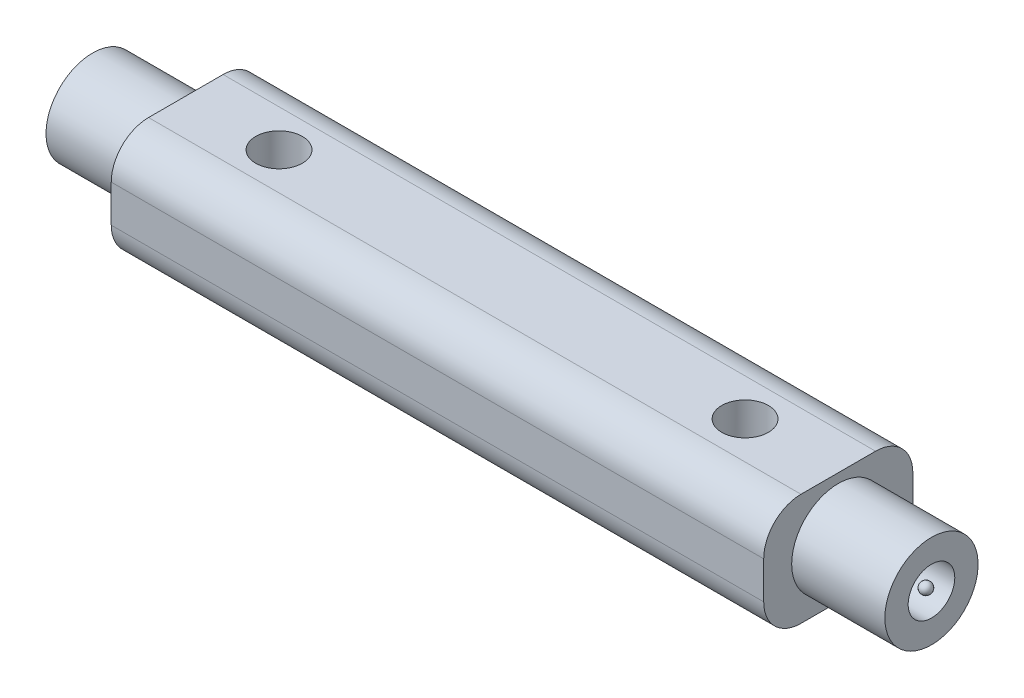
from build123d import *

# Parameters (mm, degrees)
SKETCH_1_W          = 8
SKETCH_1_H          = 6
EXTRUDE_1_DEPTH     = 17.5
SKETCH_2_R          = 2.5
EXTRUDE_2_DEPTH     = 22.5
FILLET_1_R          = 2
HOLE_WIZARD_M3_1_D  = 2.5
SKETCH_6_R          = 1
CUT_EXTRUDE_1_DEPTH = 24.627314701
HOLE_WIZARD_M3_2_D  = 2.5


with BuildPart() as part:
    # 草圖1 → 填料-伸長1 (new, symmetric)
    with BuildSketch(Plane(origin=(0, 0, 0), x_dir=(0, 0, -1), z_dir=(1, 0, 0))):
        Rectangle(SKETCH_1_W, SKETCH_1_H)
    extrude(amount=EXTRUDE_1_DEPTH, both=True)

    # 草圖2 → 填料-伸長2 (add, symmetric)
    with BuildSketch(Plane(origin=(0, 0, 0), x_dir=(0, 0, -1), z_dir=(1, 0, 0))):
        with Locations(Location((0, 0, 0), (0, 0, 180))):
            Circle(SKETCH_2_R)
    extrude(amount=EXTRUDE_2_DEPTH, both=True)

    # 圓角1
    fillet_1_edges = [part.edges().sort_by_distance(p)[0] for p in [
        (0, 3, 4),
        (0, 3, -4),
        (0, -3, -4),
        (0, -3, 4),
    ]]
    fillet(fillet_1_edges, radius=FILLET_1_R)

    # M3 螺紋孔1 (through all)
    with Locations(Plane(origin=(22.5, 0, 0), x_dir=(0, 0, -1), z_dir=(1, 0, 0))):
        with Locations((0, 0)):
            Hole(HOLE_WIZARD_M3_1_D / 2)

    # 草圖6 → 除料-伸長1 (cut, through all)
    with BuildSketch(Plane(origin=(0, 3, 0), x_dir=(1, 0, 0), z_dir=(0, 1, 0))):
        with Locations(Location((-12.5, 0, 0), (0, 0, 270))):
            Circle(SKETCH_6_R)
        with Locations(Location((12.5, 0, 0), (0, 0, 270))):
            Circle(SKETCH_6_R)
    extrude(amount=-CUT_EXTRUDE_1_DEPTH, mode=Mode.SUBTRACT)

    # M3 螺紋孔2 (through all)
    with Locations(Plane(origin=(-12.5, 3, 0), x_dir=(0, 0, 1), z_dir=(0, 1, 0))):
        with Locations((0, 0), (0, 25)):
            Hole(HOLE_WIZARD_M3_2_D / 2)


with BuildPart() as body_2:
    # 草圖10 → 旋轉1 (revolve)
    with BuildSketch(Plane(origin=(0, 0, 0), x_dir=(1, 0, 0), z_dir=(0, 1, 0))):
        with BuildLine():
            Line((21.9, 0), (22.5, 0))
            ThreePointArc((22.5, 0), (22.2, -0.3), (21.9, 0))
        make_face()
        with BuildLine():
            Line((-22.5, 0), (-21.9, 0))
            ThreePointArc((-21.9, 0), (-22.2, 0.3), (-22.5, 0))
        make_face()
    revolve(axis=Axis((-22.5, 0, 0), (1, 0, 0)))


solid = Compound([part.part, body_2.part])
